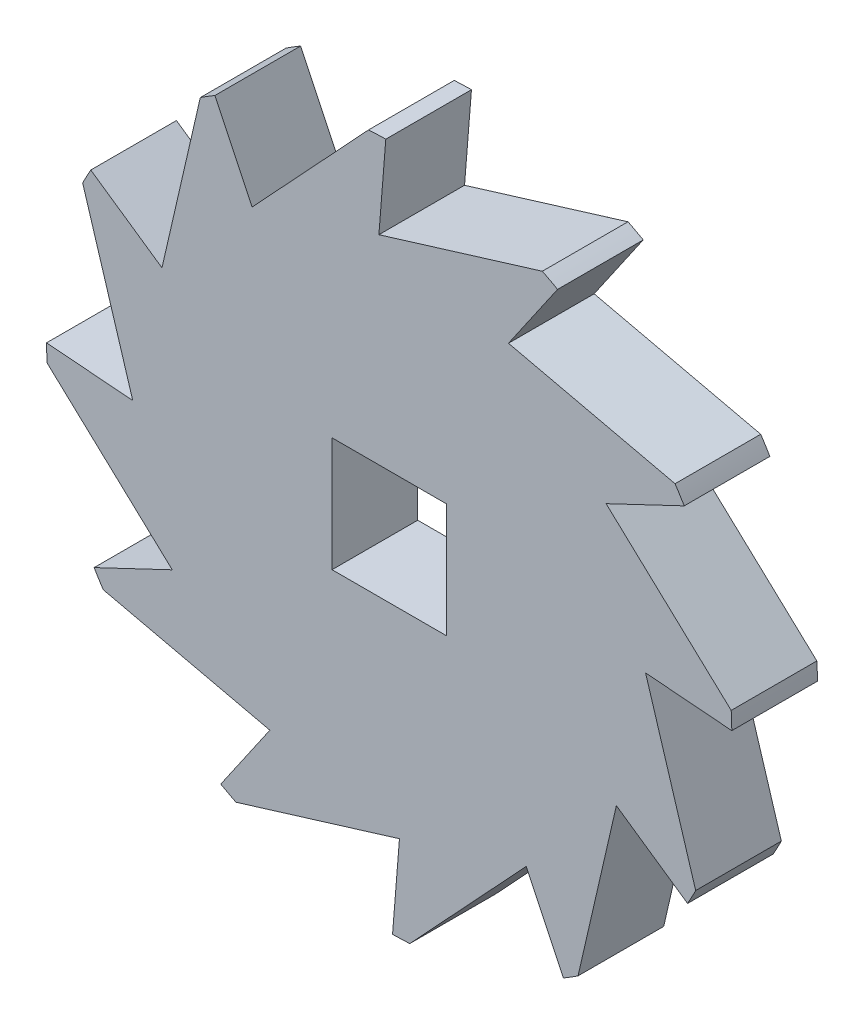
from build123d import *

# Parameters (mm, degrees)
SCHIZZO1_W                   = 10
SCHIZZO1_H                   = 10
ESTRUSIONE_ESTRUSIONE1_DEPTH = 7.5


with BuildPart() as part:
    # Schizzo1 → Estrusione-Estrusione1 (new body)
    with BuildSketch(Plane.XY):
        with BuildLine():
            Line((13.409429202, 26.836303927), (-0.9, 22.45))
            Line((-0.9, 22.45), (-0.295575686, 29.998543882))
            ThreePointArc((-0.295575686, 29.998543882), (-1.050743721, 29.981593314), (-1.805245625, 29.945635546))
            Line((-1.805245625, 29.945635546), (-12.004422863, 18.992270315))
            Line((-12.004422863, 18.992270315), (-15.255247993, 25.831713235))
            ThreePointArc((-15.255247993, 25.831713235), (-15.900767412, 25.439449595), (-16.536206344, 25.031058303))
            Line((-16.536206344, 25.031058303), (-19.892270315, 10.445577137))
            Line((-19.892270315, 10.445577137), (-26.127288921, 14.743295888))
            ThreePointArc((-26.127288921, 14.743295888), (-26.490193316, 14.080825902), (-26.836303927, 13.409429202))
            Line((-26.836303927, 13.409429202), (-22.45, -0.9))
            Line((-22.45, -0.9), (-29.998543882, -0.295575686))
            ThreePointArc((-29.998543882, -0.295575686), (-29.981593314, -1.050743721), (-29.945635546, -1.805245625))
            Line((-29.945635546, -1.805245625), (-18.992270315, -12.004422863))
            Line((-18.992270315, -12.004422863), (-25.831713235, -15.255247993))
            ThreePointArc((-25.831713235, -15.255247993), (-25.439449595, -15.900767412), (-25.031058303, -16.536206344))
            Line((-25.031058303, -16.536206344), (-10.445577137, -19.892270315))
            Line((-10.445577137, -19.892270315), (-14.743295888, -26.127288921))
            ThreePointArc((-14.743295888, -26.127288921), (-14.080825902, -26.490193316), (-13.409429202, -26.836303927))
            Line((-13.409429202, -26.836303927), (0.9, -22.45))
            Line((0.9, -22.45), (0.295575686, -29.998543882))
            ThreePointArc((0.295575686, -29.998543882), (1.050743721, -29.981593314), (1.805245625, -29.945635546))
            Line((1.805245625, -29.945635546), (12.004422863, -18.992270315))
            Line((12.004422863, -18.992270315), (15.255247993, -25.831713235))
            ThreePointArc((15.255247993, -25.831713235), (15.900767412, -25.439449595), (16.536206344, -25.031058303))
            Line((16.536206344, -25.031058303), (19.892270315, -10.445577137))
            Line((19.892270315, -10.445577137), (26.127288921, -14.743295888))
            ThreePointArc((26.127288921, -14.743295888), (26.490193316, -14.080825902), (26.836303927, -13.409429202))
            Line((26.836303927, -13.409429202), (22.45, 0.9))
            Line((22.45, 0.9), (29.998543882, 0.295575686))
            ThreePointArc((29.998543882, 0.295575686), (29.981593314, 1.050743721), (29.945635546, 1.805245625))
            Line((29.945635546, 1.805245625), (18.992270315, 12.004422863))
            Line((18.992270315, 12.004422863), (25.831713235, 15.255247993))
            ThreePointArc((25.831713235, 15.255247993), (25.439449595, 15.900767412), (25.031058303, 16.536206344))
            Line((25.031058303, 16.536206344), (10.445577137, 19.892270315))
            Line((10.445577137, 19.892270315), (14.743295888, 26.127288921))
            ThreePointArc((14.743295888, 26.127288921), (14.080825902, 26.490193316), (13.409429202, 26.836303927))
        make_face()
        Rectangle(SCHIZZO1_W, SCHIZZO1_H, mode=Mode.SUBTRACT)
    extrude(amount=ESTRUSIONE_ESTRUSIONE1_DEPTH)


solid = part.part
